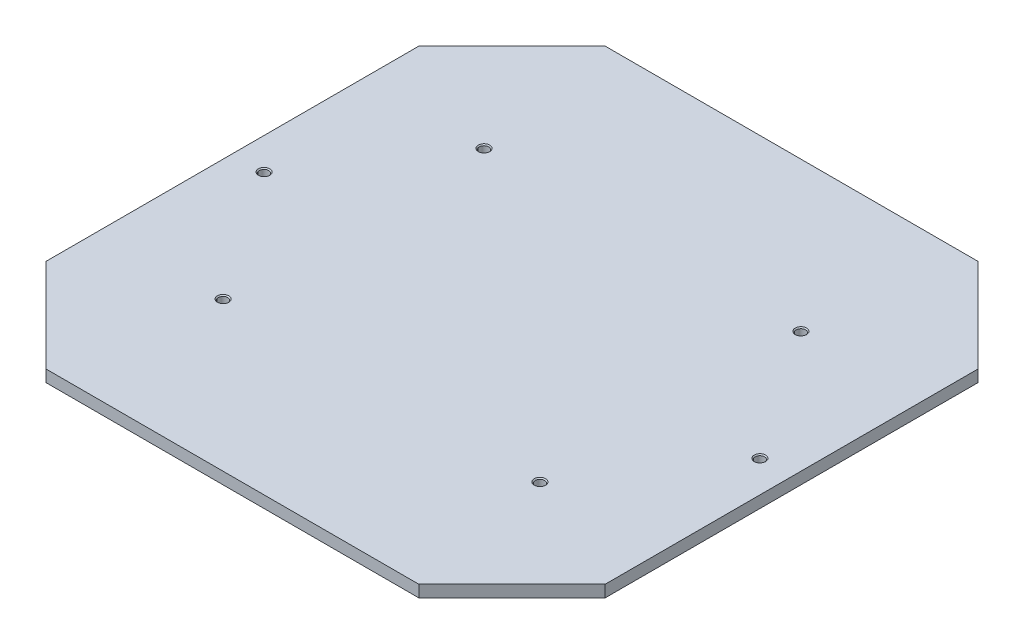
from build123d import *

# Parameters (mm, degrees)
SKETCH2_W                       = 150
SKETCH2_H                       = 150
BOSS_EXTRUDE2_DEPTH             = 3.175
CHAMFER1_SIZE                   = 25
M3X0_5_TAPPED_HOLE1_D           = 2.5
M3X0_5_TAPPED_HOLE1_CSINK_D     = 3.05
M3X0_5_TAPPED_HOLE1_CSINK_ANGLE = 90


with BuildPart() as part:
    # Sketch2 → Boss-Extrude2 (new body)
    with BuildSketch(Plane(origin=(0, 0, 0), x_dir=(1, 0, 0), z_dir=(0, 1, 0))):
        Rectangle(SKETCH2_W, SKETCH2_H)
    extrude(amount=BOSS_EXTRUDE2_DEPTH)

    # Chamfer1
    chamfer1_edges = [part.edges().sort_by_distance(p)[0] for p in [
        (75, 1.5875, 75),
        (-75, 1.5875, 75),
        (-75, 1.5875, -75),
        (75, 1.5875, -75),
    ]]
    chamfer(chamfer1_edges, length=CHAMFER1_SIZE)

    # M3x0.5 Tapped Hole1 (through all)
    with Locations(Plane(origin=(0, 3.175, 0), x_dir=(1, 0, 0), z_dir=(0, 1, 0))):
        with Locations((-42.5, 35), (42.5, 35), (-42.5, -35), (42.5, -35), (-66.5, 0), (66.5, 0)):
            CounterSinkHole(M3X0_5_TAPPED_HOLE1_D / 2, M3X0_5_TAPPED_HOLE1_CSINK_D / 2, counter_sink_angle=M3X0_5_TAPPED_HOLE1_CSINK_ANGLE)


solid = part.part
